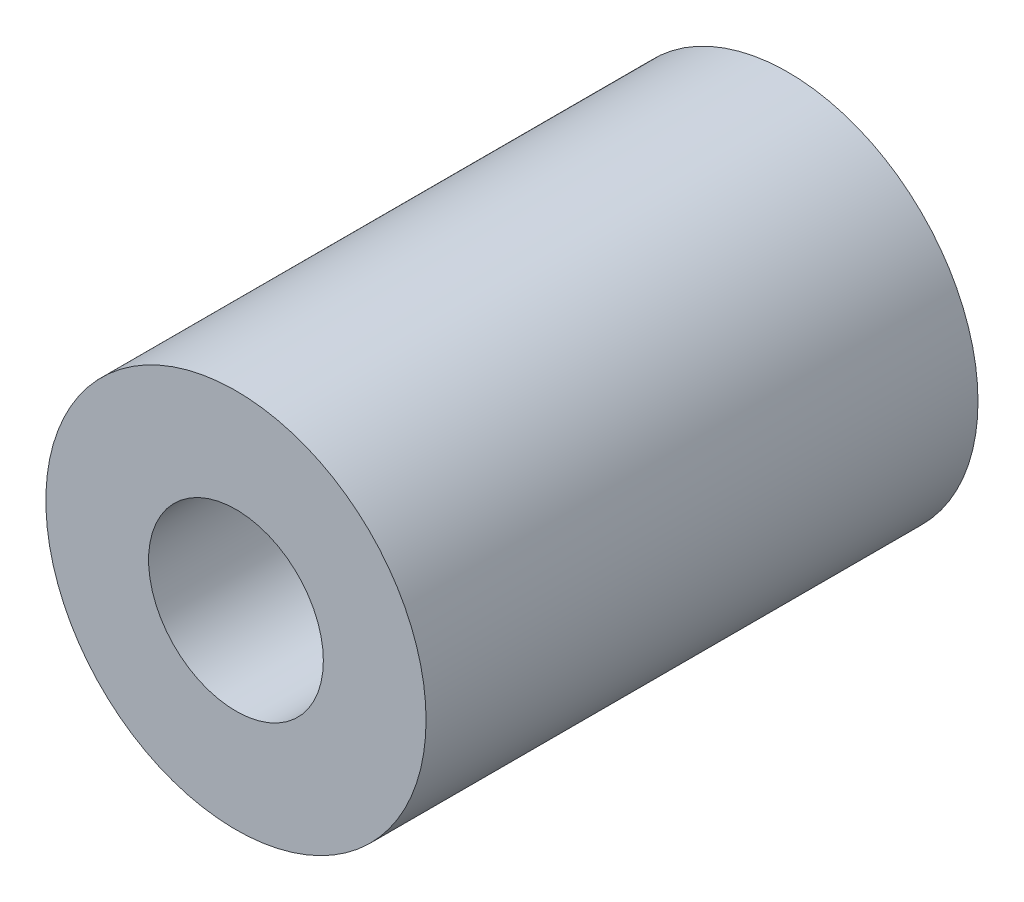
from build123d import *

# Parameters (mm, degrees)
SKETCH2_R           = 3.1
SKETCH2_R_2         = 1.425
BOSS_EXTRUDE1_DEPTH = 9


with BuildPart() as part:
    # Sketch2 → Boss-Extrude1 (new body)
    with BuildSketch(Plane.XY):
        Circle(SKETCH2_R)
        Circle(SKETCH2_R_2, mode=Mode.SUBTRACT)
    extrude(amount=BOSS_EXTRUDE1_DEPTH)


solid = part.part
